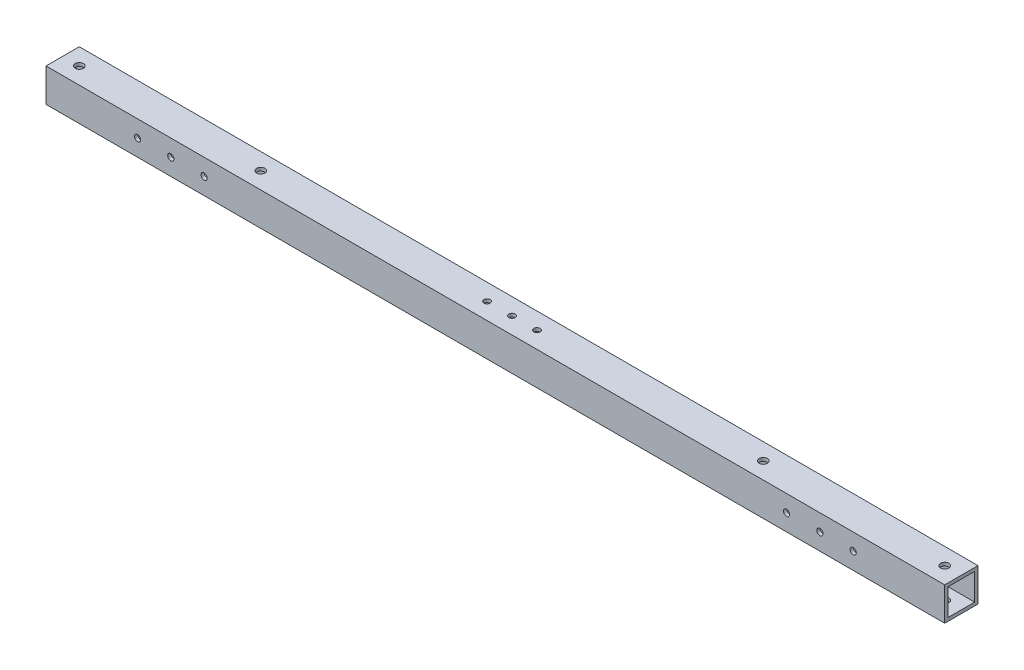
from build123d import *

# Parameters (mm, degrees)
SKETCH1_W           = 25.4
SKETCH1_H           = 25.4
SKETCH1_W_2         = 20.32
SKETCH1_H_2         = 20.32
BOSS_EXTRUDE1_DEPTH = 685.8
SKETCH2_R           = 3.175
CUT_EXTRUDE1_DEPTH  = 687.387711137
SKETCH3_R           = 2.38125
CUT_EXTRUDE2_DEPTH  = 687.387711137
SKETCH4_R           = 2.38125
CUT_EXTRUDE3_DEPTH  = 687.387711137


with BuildPart() as part:
    # Sketch1 → Boss-Extrude1 (new body)
    with BuildSketch(Plane(origin=(0, 0, 0), x_dir=(0, 0, -1), z_dir=(1, 0, 0))):
        Rectangle(SKETCH1_W, SKETCH1_H)
        Rectangle(SKETCH1_W_2, SKETCH1_H_2, mode=Mode.SUBTRACT)
    extrude(amount=BOSS_EXTRUDE1_DEPTH)

    # Sketch2 → Cut-Extrude1 (cut, through all)
    with BuildSketch(Plane(origin=(0, 12.7, 0), x_dir=(1, 0, 0), z_dir=(0, 1, 0))):
        with Locations(Location((673.1, 0, 0), (0, 0, 270))):
            Circle(SKETCH2_R)
        with Locations(Location((534.67, 0, 0), (0, 0, 270))):
            Circle(SKETCH2_R)
        with Locations(Location((151.13, 0, 0), (0, 0, 270))):
            Circle(SKETCH2_R)
        with Locations(Location((12.7, 0, 0), (0, 0, 270))):
            Circle(SKETCH2_R)
    extrude(amount=-CUT_EXTRUDE1_DEPTH, mode=Mode.SUBTRACT)

    # Sketch3 → Cut-Extrude2 (cut, through all)
    with BuildSketch(Plane(origin=(0, 12.7, 0), x_dir=(1, 0, 0), z_dir=(0, 1, 0))):
        with Locations(Location((342.9, 0, 0), (0, 0, 270))):
            Circle(SKETCH3_R)
        with Locations(Location((361.95, 0, 0), (0, 0, 270))):
            Circle(SKETCH3_R)
        with Locations(Location((323.85, 0, 0), (0, 0, 270))):
            Circle(SKETCH3_R)
    extrude(amount=-CUT_EXTRUDE2_DEPTH, mode=Mode.SUBTRACT)

    # Sketch4 → Cut-Extrude3 (cut, through all)
    with BuildSketch(Plane.XY.offset(12.7)):
        with Locations((615.95, 0)):
            Circle(SKETCH4_R)
        with Locations((590.55, 0)):
            Circle(SKETCH4_R)
        with Locations((565.15, 0)):
            Circle(SKETCH4_R)
        with Locations(Location((120.65, 0, 0), (0, 0, 180))):
            Circle(SKETCH4_R)
        with Locations(Location((95.25, 0, 0), (0, 0, 180))):
            Circle(SKETCH4_R)
        with Locations(Location((69.85, 0, 0), (0, 0, 180))):
            Circle(SKETCH4_R)
    extrude(amount=-CUT_EXTRUDE3_DEPTH, mode=Mode.SUBTRACT)


solid = part.part
